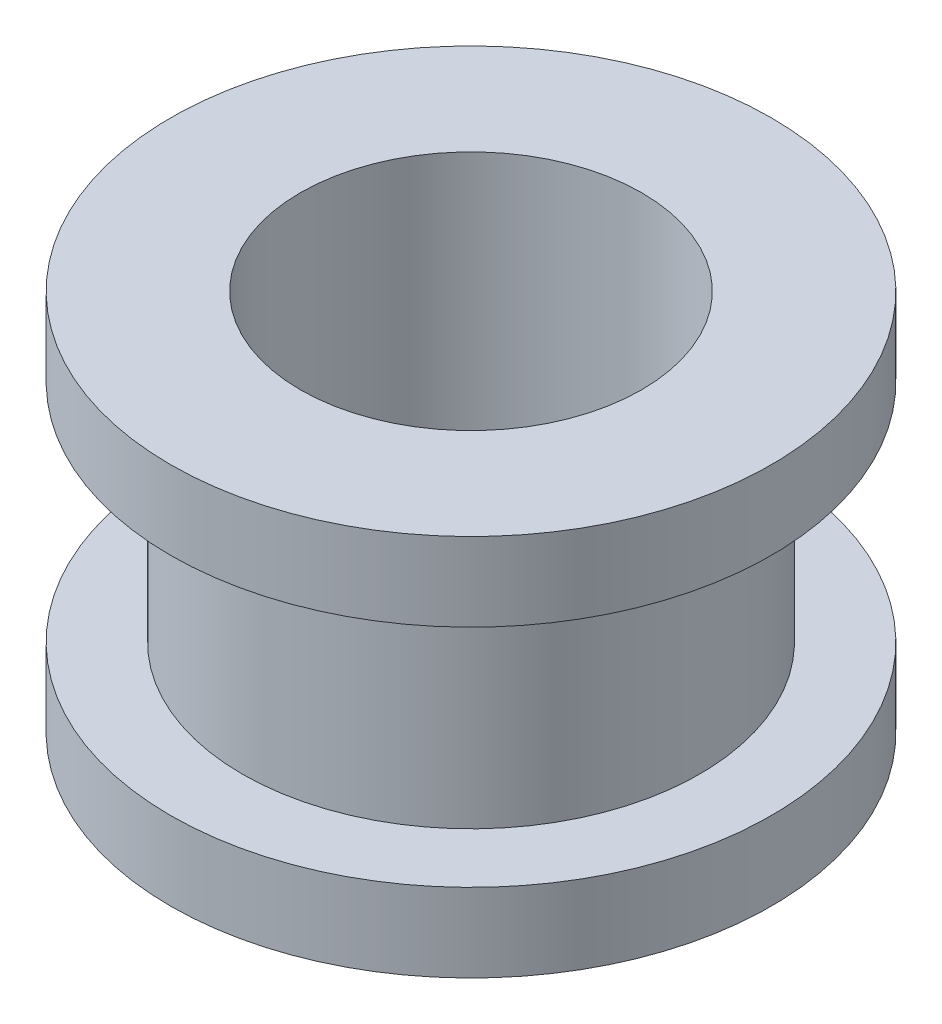
from build123d import *

# Parameters (mm, degrees)
CUT_EXTRUDE1_DEPTH      = 14.646977687
CUT_EXTRUDE1_DEPTH_BACK = 14.646977687
SKETCH2_R               = 5


with BuildPart() as part:
    # Sketch1 → Revolve1 (revolve)
    with BuildSketch(Plane.XY, mode=Mode.PRIVATE) as revolve1_sk:
        Polygon((0, 5.6), (-8.8, 5.6), (-8.8, 3.3), (-6.7, 3.3), (-6.7, -3.3), (-8.8, -3.3), (-8.8, -5.6), (0, -5.6), align=None)
    revolve(revolve1_sk.sketch.rotate(Axis((0, -5.6, 0), (0, 1, 0)), 270), axis=Axis((0, -5.6, 0), (0, 1, 0)))

    # Sketch2 → Cut-Extrude1 (cut, two sides: drawn at the far end of the back side and taken through both)
    with BuildSketch(Plane(origin=(0, 0, 0), x_dir=(1, 0, 0), z_dir=(0, 1, 0)).offset(-CUT_EXTRUDE1_DEPTH_BACK)):
        with Locations(Location((0, 0, 0), (0, 0, 270))):
            Circle(SKETCH2_R)
    extrude(amount=CUT_EXTRUDE1_DEPTH + CUT_EXTRUDE1_DEPTH_BACK, mode=Mode.SUBTRACT)


solid = part.part
